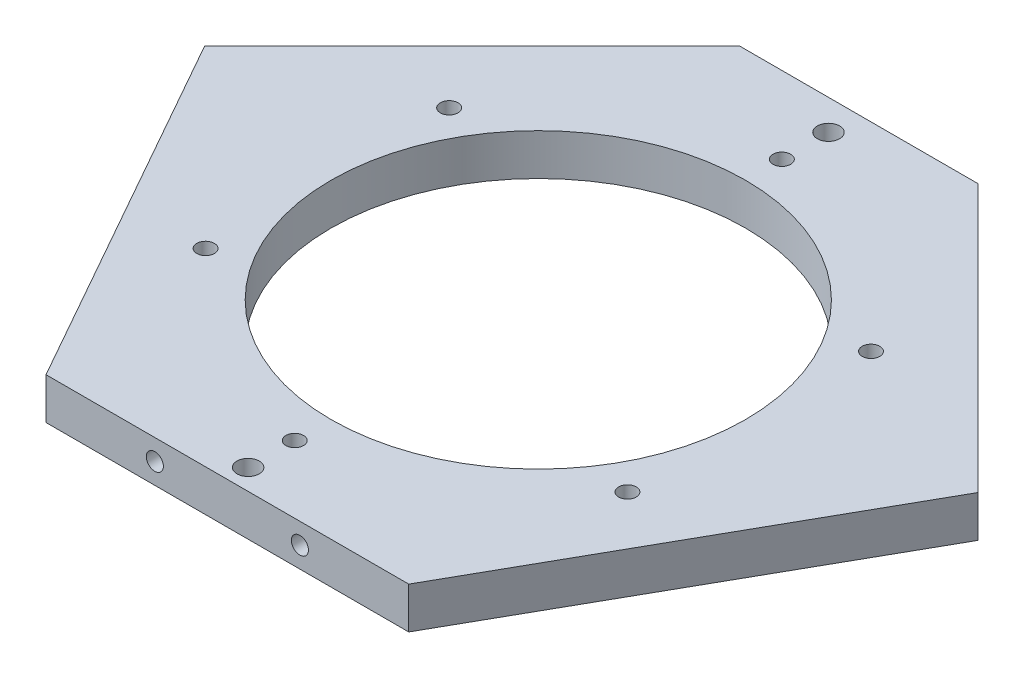
from build123d import *

# Parameters (mm, degrees)
SKETCH_2_R                  = 40
EXTRUDE_1_DEPTH             = 4
HOLE_WIZARD_M3_1_D          = 3.4
HOLE_WIZARD_M4_1_AT_2_COUNT = 2
HOLE_WIZARD_M4_1_AT_2_PITCH = 28
HOLE_WIZARD_M4_3_D          = 3.3
HOLE_WIZARD_M4_3_DEPTH      = 15
HOLE_WIZARD_M4_3_TIP        = 0.991420021
HOLE_WIZARD_M4_2_D          = 4.3


with BuildPart() as part:
    # 草图2 → 凸台-拉伸1 (new, symmetric)
    with BuildSketch(Plane(origin=(0, 0, 0), x_dir=(1, 0, 0), z_dir=(0, 1, 0))):
        Polygon((23, 61.852813742), (-23, 61.852813742), (-74.618795027, 10.234018716), (-35, -60), (35, -60), (74.618795027, 10.234018716), align=None)
        with Locations(Location((0, 0, 0), (0, 0, 270))):
            Circle(SKETCH_2_R, mode=Mode.SUBTRACT)
    extrude(amount=EXTRUDE_1_DEPTH, both=True)

    # M3 间隙孔1 (through all)
    with Locations(Plane(origin=(0, 4, 0), x_dir=(1, 0, 0), z_dir=(0, 1, 0))):
        with Locations((0, 47), (40.703193978, 23.5), (40.703193978, -23.5), (0, -47), (-40.703193978, -23.5), (-40.703193978, 23.5)):
            Hole(HOLE_WIZARD_M3_1_D / 2)

    # 草图7 → Hole Wizard M4 _1 (revolve, cut)
    with BuildSketch(Plane(origin=(38.820162287, 0, -46.032651455), x_dir=(-0.7071067811865476, 0, -0.7071067811865476), z_dir=(0, 1, 0))):
        Polygon((0, 0), (0, 12.991420021), (1.65, 12), (1.65, 0), align=None)
    hole_wizard_m4_1 = revolve(axis=Axis((43.310290348, 0, -50.522779516), (-0.7071067811865476, 0, 0.7071067811865476)), mode=Mode.SUBTRACT)

    # Hole Wizard M4 _1 at 2: Hole Wizard M4 _1 ×2
    with Locations(*[Vector(0.7071067811865476, 0, 0.7071067811865476) * (i * HOLE_WIZARD_M4_1_AT_2_PITCH) for i in range(1, HOLE_WIZARD_M4_1_AT_2_COUNT)]):
        add(hole_wizard_m4_1, mode=Mode.SUBTRACT)

    # 镜向1: Hole Wizard M4 _1 across plane
    add(hole_wizard_m4_1.mirror(Plane(origin=(0, 0, 0), x_dir=(0, 0, 1), z_dir=(1, 0, 0))), mode=Mode.SUBTRACT)

    # 镜向1 copy 1 sketch → 镜向1 copy 1 (revolve, cut)
    with BuildSketch(Plane(origin=(-58.61915216, 0, -26.233661582), x_dir=(0.7071067811865476, 0, -0.7071067811865476), z_dir=(0, 1, 0))):
        Polygon((0, 0), (0, -12.991420021), (1.65, -12), (1.65, 0), align=None)
    revolve(axis=Axis((-63.109280221, 0, -30.723789643), (-0.7071067811865476, 0, -0.7071067811865476)), mode=Mode.SUBTRACT)

    # M4 螺纹孔3
    with Locations(Plane.XY.offset(60)):
        with Locations((14, 0), (-14, 0)):
            Hole(HOLE_WIZARD_M4_3_D / 2, depth=HOLE_WIZARD_M4_3_DEPTH)
            with Locations((0, 0, -(HOLE_WIZARD_M4_3_DEPTH + HOLE_WIZARD_M4_3_TIP / 2))):  # 118° drill point
                Cone(0, HOLE_WIZARD_M4_3_D / 2, HOLE_WIZARD_M4_3_TIP, mode=Mode.SUBTRACT)

    # M4 间隙孔2 (through all)
    with Locations(Plane(origin=(0, 4, 0), x_dir=(1, 0, 0), z_dir=(0, 1, 0))):
        with Locations((0, 56), (0, -56)):
            Hole(HOLE_WIZARD_M4_2_D / 2)


solid = part.part
